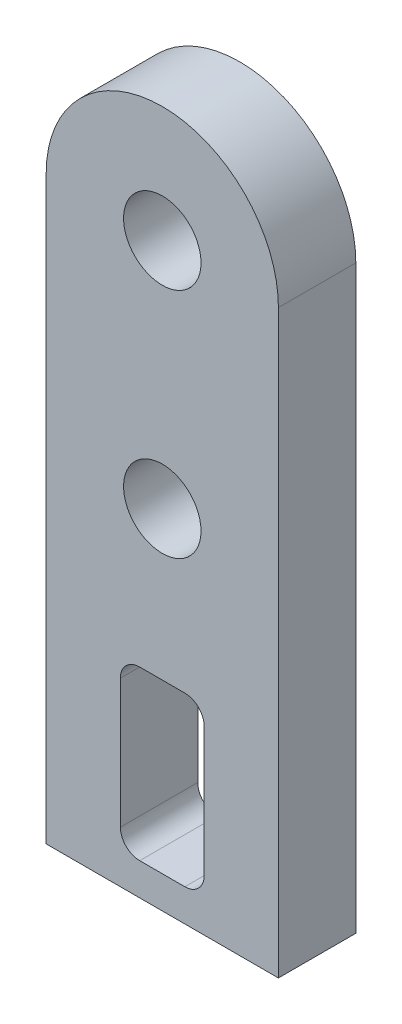
from build123d import *

# Parameters (mm, degrees)
MODEL_R                 = 1.5
SALIENTE_EXTRUIR1_DEPTH = 3


with BuildPart() as part:
    # Model → Saliente-Extruir1 (new body)
    with BuildSketch(Plane.XY):
        with BuildLine():
            Line((202.97316991, 160.056557042), (202.97316991, 182.556557042))
            ThreePointArc((202.97316991, 182.556557042), (207.47316991, 187.056557042), (211.97316991, 182.556557042))
            Line((211.97316991, 182.556557042), (211.97316991, 160.056557042))
            Line((211.97316991, 160.056557042), (202.97316991, 160.056557042))
        make_face()
        with Locations((207.47316991, 173.556557042)):
            Circle(MODEL_R, mode=Mode.SUBTRACT)
        with Locations((207.47316991, 182.556557042)):
            Circle(MODEL_R, mode=Mode.SUBTRACT)
        with BuildLine():
            Line((205.84816991, 162.056557042), (205.84816991, 167.056557042))
            ThreePointArc((205.84816991, 167.056557042), (206.067839825, 167.586887128), (206.59816991, 167.806557042))
            Line((206.59816991, 167.806557042), (208.34816991, 167.806557042))
            ThreePointArc((208.34816991, 167.806557042), (208.878499996, 167.586887128), (209.09816991, 167.056557042))
            Line((209.09816991, 167.056557042), (209.09816991, 162.056557042))
            ThreePointArc((209.09816991, 162.056557042), (208.878499996, 161.526226956), (208.34816991, 161.306557042))
            Line((208.34816991, 161.306557042), (206.59816991, 161.306557042))
            ThreePointArc((206.59816991, 161.306557042), (206.067839825, 161.526226956), (205.84816991, 162.056557042))
        make_face(mode=Mode.SUBTRACT)
    extrude(amount=SALIENTE_EXTRUIR1_DEPTH)


solid = part.part
